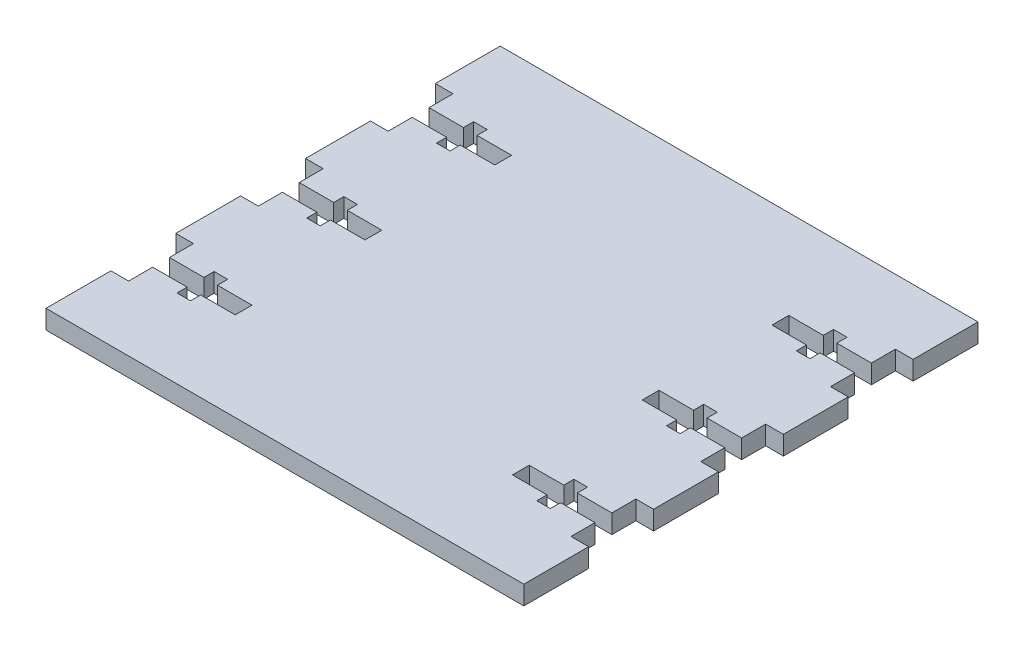
from build123d import *

# Parameters (mm, degrees)
SKETCH1_W                 = 75
SKETCH1_H                 = 77
BOSS_EXTRUDE1_DEPTH       = 3.2
SKETCH2_W                 = 3
SKETCH2_H                 = 11
BOSS_EXTRUDE3_DEPTH       = 3.2
LPATTERN1_COUNT           = 4
LPATTERN1_PITCH           = 22
SKETCH4_W                 = 3
SKETCH4_H                 = 11
BOSS_EXTRUDE5_DEPTH       = 3.2
LPATTERN2_COUNT           = 4
LPATTERN2_PITCH           = 22
SKETCH5_W                 = 14
SKETCH5_H                 = 2.85
SKETCH5_W_2               = 2.3
SKETCH5_H_2               = 6.3
CUT_EXTRUDE1_DEPTH        = 56.970885289
LPATTERN3_COUNT           = 3
LPATTERN3_PITCH           = 22
MIRROR1_COPY_1_SKETCH_W   = 14
MIRROR1_COPY_1_SKETCH_H   = 2.85
MIRROR1_COPY_1_SKETCH_W_2 = 2.3
MIRROR1_COPY_1_SKETCH_H_2 = 6.3
MIRROR1_COPY_1_DEPTH      = 56.970885289
MIRROR1_COPY_2_SKETCH_W   = 14
MIRROR1_COPY_2_SKETCH_H   = 2.85
MIRROR1_COPY_2_SKETCH_W_2 = 2.3
MIRROR1_COPY_2_SKETCH_H_2 = 6.3
MIRROR1_COPY_2_DEPTH      = 56.970885289


with BuildPart() as part:
    # Sketch1 → Boss-Extrude1 (new body)
    with BuildSketch(Plane(origin=(0, 0, 0), x_dir=(1, 0, 0), z_dir=(0, 1, 0))):
        Rectangle(SKETCH1_W, SKETCH1_H)
    extrude(amount=BOSS_EXTRUDE1_DEPTH)

    # Sketch2 → Boss-Extrude3 (add)
    with BuildSketch(Plane(origin=(0, 3.2, 0), x_dir=(1, 0, 0), z_dir=(0, 1, 0))):
        with Locations((-39, 33)):
            Rectangle(SKETCH2_W, SKETCH2_H)
    boss_extrude3 = extrude(amount=-BOSS_EXTRUDE3_DEPTH)

    # LPattern1: Boss-Extrude3 ×4
    with Locations(*[(0, 0, i * LPATTERN1_PITCH) for i in range(1, LPATTERN1_COUNT)]):
        add(boss_extrude3)

    # Sketch4 → Boss-Extrude5 (add)
    with BuildSketch(Plane(origin=(0, 3.2, 0), x_dir=(1, 0, 0), z_dir=(0, 1, 0))):
        with Locations((39, 33)):
            Rectangle(SKETCH4_W, SKETCH4_H)
    boss_extrude5 = extrude(amount=-BOSS_EXTRUDE5_DEPTH)

    # LPattern2: Boss-Extrude5 ×4
    with Locations(*[(0, 0, i * LPATTERN2_PITCH) for i in range(1, LPATTERN2_COUNT)]):
        add(boss_extrude5)

    # Sketch5 → Cut-Extrude1 (cut, through all)
    with BuildSketch(Plane(origin=(0, 3.2, 0), x_dir=(1, 0, 0), z_dir=(0, 1, 0))):
        with Locations((-30.5, 22)):
            Rectangle(SKETCH5_W, SKETCH5_H)
        with Locations((-30.5, 22)):
            Rectangle(SKETCH5_W_2, SKETCH5_H_2)
    cut_extrude1 = extrude(amount=-CUT_EXTRUDE1_DEPTH, mode=Mode.SUBTRACT)

    # LPattern3: Cut-Extrude1 ×3
    with Locations(*[(0, 0, i * LPATTERN3_PITCH) for i in range(1, LPATTERN3_COUNT)]):
        add(cut_extrude1, mode=Mode.SUBTRACT)

    # Mirror1: Cut-Extrude1 across plane
    add(cut_extrude1.mirror(Plane(origin=(0, 0, 0), x_dir=(0, 0, 1), z_dir=(1, 0, 0))), mode=Mode.SUBTRACT)

    # Mirror1 copy 1 sketch → Mirror1 copy 1 (cut, through all)
    with BuildSketch(Plane(origin=(0, 3.2, 22), x_dir=(-1, 0, 0), z_dir=(0, 1, 0))):
        with Locations((-30.5, -22)):
            Rectangle(MIRROR1_COPY_1_SKETCH_W, MIRROR1_COPY_1_SKETCH_H)
        with Locations((-30.5, -22)):
            Rectangle(MIRROR1_COPY_1_SKETCH_W_2, MIRROR1_COPY_1_SKETCH_H_2)
    extrude(amount=-MIRROR1_COPY_1_DEPTH, mode=Mode.SUBTRACT)

    # Mirror1 copy 2 sketch → Mirror1 copy 2 (cut, through all)
    with BuildSketch(Plane(origin=(0, 3.2, 44), x_dir=(-1, 0, 0), z_dir=(0, 1, 0))):
        with Locations((-30.5, -22)):
            Rectangle(MIRROR1_COPY_2_SKETCH_W, MIRROR1_COPY_2_SKETCH_H)
        with Locations((-30.5, -22)):
            Rectangle(MIRROR1_COPY_2_SKETCH_W_2, MIRROR1_COPY_2_SKETCH_H_2)
    extrude(amount=-MIRROR1_COPY_2_DEPTH, mode=Mode.SUBTRACT)


solid = part.part
